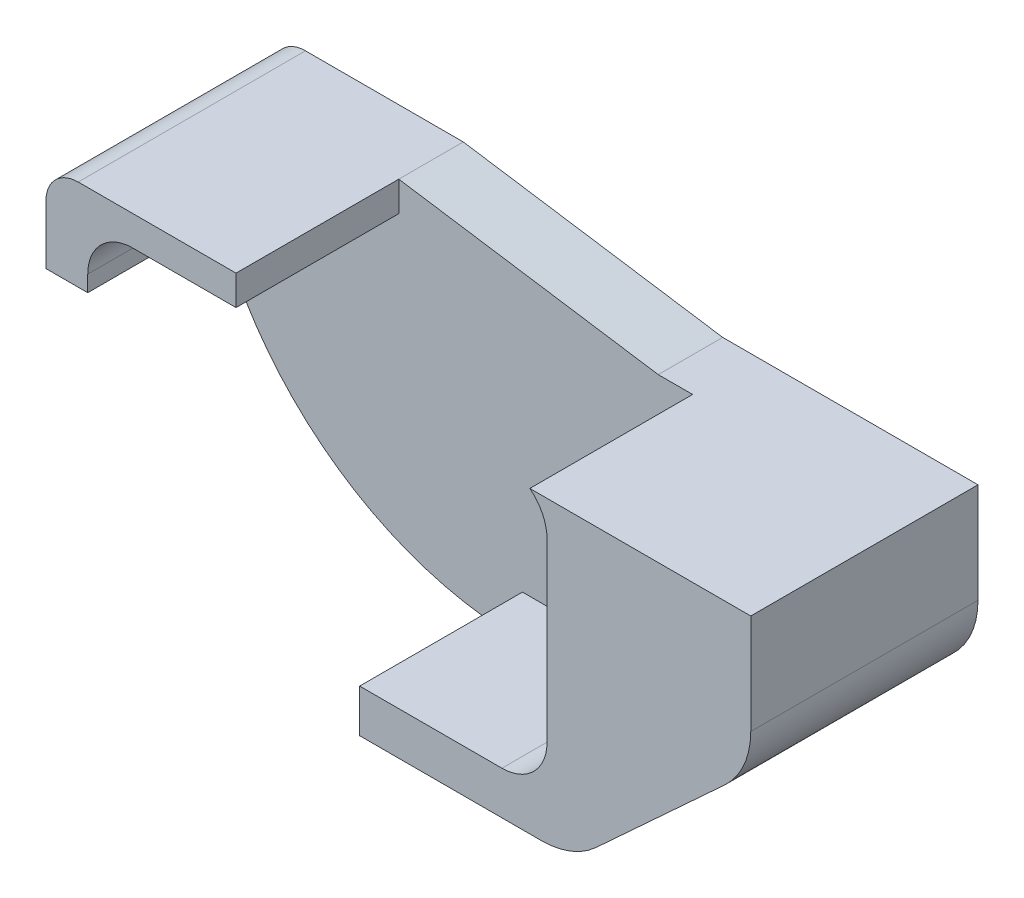
from build123d import *

# Parameters (mm, degrees)
BOSS_EXTRUDE1_DEPTH                                 = 10.1
SKETCH2_W                                           = 10.1
SKETCH2_H                                           = 2.668782353
BOSS_EXTRUDE2_DEPTH                                 = 11.626285019
BOSS_EXTRUDE3_DEPTH                                 = 4
SKETCH4_W                                           = 11.790327601
SKETCH4_H                                           = 5.654182735
BOSS_EXTRUDE4_DEPTH                                 = 10.1
CUT_EXTRUDE1_REACH                                  = 32.993
SKETCH6_W                                           = 5.300644637
SKETCH6_H                                           = 10.1
CBORE_FOR_4_BINDING_HEAD_MACHINE_SCREW1_D           = 3.4
CBORE_FOR_4_BINDING_HEAD_MACHINE_SCREW1_CBORE_D     = 6
CBORE_FOR_4_BINDING_HEAD_MACHINE_SCREW1_CBORE_DEPTH = 2.4
CBORE_FOR_4_BINDING_HEAD_MACHINE_SCREW2_D           = 3.4544
CBORE_FOR_4_BINDING_HEAD_MACHINE_SCREW2_CBORE_D     = 5.999999938
CBORE_FOR_4_BINDING_HEAD_MACHINE_SCREW2_CBORE_DEPTH = 2.400000026
FILLET1_R                                           = 2
FILLET2_R                                           = 3.2
FILLET3_R                                           = 5
CUT_EXTRUDE2_DEPTH                                  = 10.1


with BuildPart() as part:
    # Sketch1 → Boss-Extrude1 (new body)
    with BuildSketch(Plane.XY.offset(10.1)):
        with BuildLine():
            Line((8.423890913, 5.257630162), (8.423890913, -10.111152191))
            Line((8.423890913, -10.111152191), (10.022735266, -10.111152191))
            Line((10.022735266, -10.111152191), (21.064470639, 0.057225582))
            Line((21.064470639, 0.057225582), (21.064470639, 8.457630162))
            Line((21.064470639, 8.457630162), (5.223890913, 8.457630162))
            ThreePointArc((5.223890913, 8.457630162), (7.486632612, 7.520371862), (8.423890913, 5.257630162))
        make_face()
    extrude(amount=-BOSS_EXTRUDE1_DEPTH)

    # Sketch2 → Boss-Extrude2 (add)
    with BuildSketch(Plane.ZY.offset(-8.423890913)):
        with Locations((5.05, -8.776761014)):
            Rectangle(SKETCH2_W, SKETCH2_H)
    extrude(amount=BOSS_EXTRUDE2_DEPTH)

    # Sketch3 → Boss-Extrude3 (add)
    with BuildSketch(Plane(origin=(0, 0, 0), x_dir=(-1, 0, 0), z_dir=(0, 0, -1))):
        with BuildLine():
            Line((3.202394106, -10.111152191), (-10.022735266, -10.111152191))
            Line((-10.022735266, -10.111152191), (-21.064470639, 0.057225582))
            Line((-21.064470639, 0.057225582), (-21.064470639, 8.457630162))
            Line((-21.064470639, 8.457630162), (-5.223890913, 8.457630162))
            Line((-5.223890913, 8.457630162), (10.87546445, 10.911812897))
            Line((10.87546445, 10.911812897), (22.665792051, 10.911812897))
            Line((22.665792051, 10.911812897), (22.665792051, 5.257630162))
            ThreePointArc((22.665792051, 5.257630162), (15.602226067, -5.805749207), (3.202394106, -10.111152191))
        make_face()
    extrude(amount=BOSS_EXTRUDE3_DEPTH)

    # Sketch4 → Boss-Extrude4 (add)
    with BuildSketch(Plane.XY):
        with Locations((-16.77062825, 8.08472153)):
            Rectangle(SKETCH4_W, SKETCH4_H)
    extrude(amount=BOSS_EXTRUDE4_DEPTH)

    # Sketch6 → Cut-Extrude1 (cut, up to next)
    with BuildSketch(Plane(origin=(0, 8.457630162, 0), x_dir=(1, 0, 0), z_dir=(0, 1, 0)), mode=Mode.PRIVATE) as cut_extrude1_sk1:
        with Locations((-13.525786769, -5.05)):
            Rectangle(SKETCH6_W, SKETCH6_H)
    cut_extrude1_tool1 = extrude(cut_extrude1_sk1.sketch, amount=-CUT_EXTRUDE1_REACH, mode=Mode.PRIVATE) & part.part
    add(cut_extrude1_tool1.solids().sort_by_distance((-13.525787, 8.45763, 5.05))[0], mode=Mode.SUBTRACT)

    # CBORE for #4 Binding Head Machine Screw1 (through all)
    with Locations(Plane(origin=(0, 0, -4), x_dir=(-1, 0, 0), z_dir=(0, 0, -1))):
        with Locations((-5.423890913, -4.442369838)):
            CounterBoreHole(CBORE_FOR_4_BINDING_HEAD_MACHINE_SCREW1_D / 2, CBORE_FOR_4_BINDING_HEAD_MACHINE_SCREW1_CBORE_D / 2, CBORE_FOR_4_BINDING_HEAD_MACHINE_SCREW1_CBORE_DEPTH)

    # CBORE for #4 Binding Head Machine Screw2 (through all)
    with Locations(Plane(origin=(0, 0, -4), x_dir=(-1, 0, 0), z_dir=(0, 0, -1))):
        with Locations((17.076109087, 6.057630162)):
            CounterBoreHole(CBORE_FOR_4_BINDING_HEAD_MACHINE_SCREW2_D / 2, CBORE_FOR_4_BINDING_HEAD_MACHINE_SCREW2_CBORE_D / 2, CBORE_FOR_4_BINDING_HEAD_MACHINE_SCREW2_CBORE_DEPTH)

    # Fillet1
    fillet1_edges = [part.edges().sort_by_distance(p)[0] for p in [
        (-22.665792051, 10.911812897, 3.05),
    ]]
    fillet(fillet1_edges, radius=FILLET1_R)

    # Fillet2
    fillet2_edges = [part.edges().sort_by_distance(p)[0] for p in [
        (8.423890913, -7.442369838, 5.05),
    ]]
    fillet(fillet2_edges, radius=FILLET2_R)

    # Fillet3
    fillet3_edges = [part.edges().sort_by_distance(p)[0] for p in [
        (21.064470639, 0.057225582, 3.05),
        (10.022735266, -10.111152191, 3.05),
    ]]
    fillet(fillet3_edges, radius=FILLET3_R)

    # Sketch11 → Cut-Extrude2 (cut)
    with BuildSketch(Plane.XY.offset(10.1)):
        with BuildLine():
            Line((5.623890913, -7.442369838), (-20.076109087, -7.442369838))
            Line((-20.076109087, -7.442369838), (-20.076109087, 6.257630162))
            ThreePointArc((-20.076109087, 6.257630162), (-19.256008075, 8.23752915), (-17.276109087, 9.057630162))
            Line((-17.276109087, 9.057630162), (5.623890913, 9.057630162))
            ThreePointArc((5.623890913, 9.057630162), (7.6037899, 8.23752915), (8.423890913, 6.257630162))
            Line((8.423890913, 6.257630162), (8.423890913, -4.642369838))
            ThreePointArc((8.423890913, -4.642369838), (7.6037899, -6.622268825), (5.623890913, -7.442369838))
        make_face()
    extrude(amount=-CUT_EXTRUDE2_DEPTH, mode=Mode.SUBTRACT)


solid = part.part
